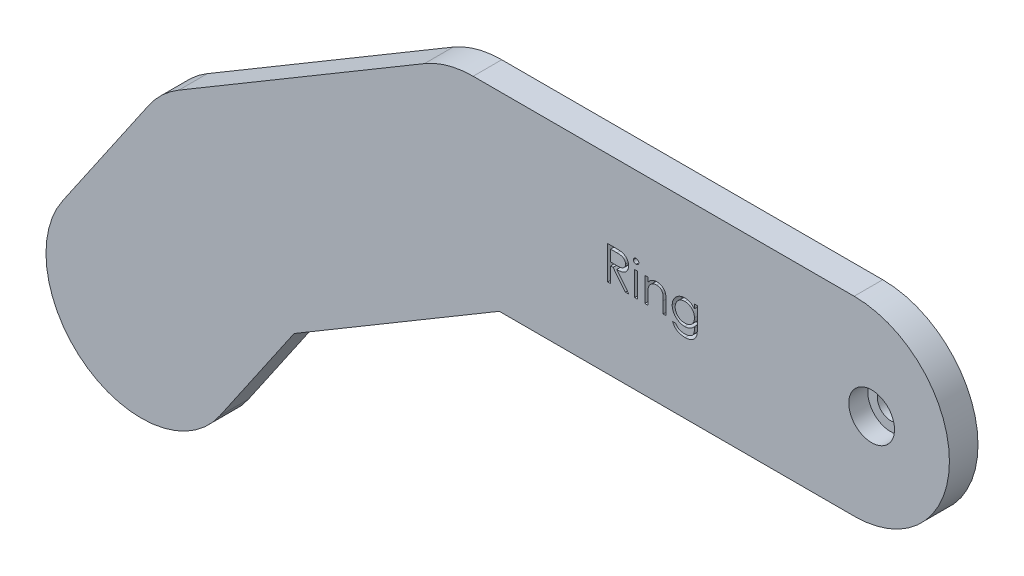
from build123d import *

# Parameters (mm, degrees)
BOSS_EXTRUDE1_DEPTH = 3
BOSS_EXTRUDE2_DEPTH = 3
BOSS_EXTRUDE4_DEPTH = 3
SKETCH4_R           = 1.4
CUT_EXTRUDE5_DEPTH  = 3
SKETCH5_R           = 2.4
CUT_EXTRUDE6_DEPTH  = 2
SKETCH7_W           = 0.314102564
SKETCH7_H           = 2.557692308
CUT_EXTRUDE7_DEPTH  = 1


with BuildPart() as part:
    # Sketch1 → Boss-Extrude1 (new body)
    with BuildSketch(Plane.XY):
        with BuildLine():
            Line((0, 10), (40, 10))
            ThreePointArc((40, 10), (50, 0), (40, -10))
            Line((40, -10), (0, -10))
            ThreePointArc((0, -10), (-10, 0), (0, 10))
        make_face()
    extrude(amount=BOSS_EXTRUDE1_DEPTH)

    # Sketch2 → Boss-Extrude2 (add)
    with BuildSketch(Plane.XY):
        with BuildLine():
            Line((5.104260767, -8.599216361), (-20.693388315, -23.911998663))
            ThreePointArc((-20.693388315, -23.911998663), (-34.396865443, -20.417043069), (-30.90190985, -6.713565941))
            Line((-30.90190985, -6.713565941), (-5.104260767, 8.599216361))
            ThreePointArc((-5.104260767, 8.599216361), (8.599216361, 5.104260767), (5.104260767, -8.599216361))
        make_face()
    extrude(amount=BOSS_EXTRUDE2_DEPTH)

    # Sketch3 → Boss-Extrude4 (add)
    with BuildSketch(Plane.XY):
        with BuildLine():
            Line((-17.548569958, -20.965453669), (-26.592844146, -34.163980269))
            ThreePointArc((-26.592844146, -34.163980269), (-40.494594638, -36.760388026), (-43.091002396, -22.858637534))
            Line((-43.091002396, -22.858637534), (-34.046728207, -9.660110934))
            ThreePointArc((-34.046728207, -9.660110934), (-20.144977715, -7.063703177), (-17.548569958, -20.965453669))
        make_face()
    extrude(amount=BOSS_EXTRUDE4_DEPTH)

    # Sketch4 → Cut-Extrude5 (cut)
    with BuildSketch(Plane.XY):
        with Locations((41.835442891, 0)):
            Circle(SKETCH4_R)
    extrude(amount=CUT_EXTRUDE5_DEPTH, mode=Mode.SUBTRACT)

    # Sketch5 → Cut-Extrude6 (cut)
    with BuildSketch(Plane.XY.offset(3)):
        with Locations((41.835442891, 0)):
            Circle(SKETCH5_R)
    extrude(amount=-CUT_EXTRUDE6_DEPTH, mode=Mode.SUBTRACT)

    # Sketch7 → Cut-Extrude7 (cut)
    # profile 1 of 5: a face of its own
    with BuildSketch(Plane.XY.offset(3)):
        with BuildLine():
            Line((14.119365842, 1.855353643), (14.819786515, 1.855353643))
            add(Edge.make_bspline(
                [(14.819786515, 1.855353643), (14.866527644, 1.855198057), (14.956275788, 1.854899315), (15.084849058, 1.853233552), (15.201676155, 1.848459197), (15.306695995, 1.844350613), (15.39990665, 1.836858672), (15.48159394, 1.829698025), (15.551381638, 1.820324364), (15.593627489, 1.811618941), (15.612755265, 1.807677361)],
                knots=[0, 0, 0, 0, 1.410062039, 2.707475311, 3.878576406, 4.937260626, 5.877586885, 6.699081471, 7.410979367, 8, 8, 8, 8], degree=3))
            add(Edge.make_bspline(
                [(15.612755265, 1.807677361), (15.638361889, 1.801350596), (15.689028879, 1.788832032), (15.761978945, 1.762372432), (15.831493269, 1.731752807), (15.897283093, 1.695789087), (15.959018884, 1.654214307), (16.017337195, 1.607746185), (16.072502658, 1.556638979), (16.122284289, 1.499604137), (16.16922334, 1.439767628), (16.208811967, 1.375063871), (16.242938447, 1.307402343), (16.270108964, 1.236094925), (16.291986937, 1.161833154), (16.307413176, 1.083944357), (16.316664364, 1.002783382), (16.31760622, 0.947425473), (16.318083791, 0.919356047)],
                knots=[0, 0, 0, 0, 1.027469482, 2.033020251, 3.019912614, 3.986113645, 4.951240523, 5.91722682, 6.890402269, 7.87763091, 8.8651537, 9.85103654, 10.82876324, 11.815024772, 12.821070561, 13.842952187, 14.906261191, 16, 16, 16, 16], degree=3))
            add(Edge.make_bspline(
                [(16.318083791, 0.919356047), (16.316614793, 0.872720943), (16.313748397, 0.781723775), (16.287023293, 0.649662893), (16.243246773, 0.526473579), (16.182923484, 0.412310941), (16.106104009, 0.309400295), (16.013779218, 0.21900984), (15.905897606, 0.143369928), (15.80546829, 0.090917123), (15.716754091, 0.057324214), (15.643720778, 0.033687855), (15.5640538, 0.01542589), (15.478516466, -0.000934242), (15.38675281, -0.013285936), (15.288982771, -0.022332531), (15.185136619, -0.027986579), (15.11379755, -0.028828584), (15.077098214, -0.029261741)],
                knots=[0, 0, 0, 0, 1.260483769, 2.459530307, 3.627416485, 4.787058657, 5.939039949, 7.08810263, 8.267026773, 9.491475466, 10.141966685, 10.831826277, 11.566392101, 12.351337768, 13.187381173, 14.07005841, 15.007169909, 16, 16, 16, 16], degree=3))
            Line((15.077098214, -0.029261741), (16.362955586, -1.644646357))
            Line((16.362955586, -1.644646357), (15.974534111, -1.644646357))
            Line((15.974534111, -1.644646357), (14.688676739, -0.029261741))
            Line((14.688676739, -0.029261741), (14.433468406, -0.029261741))
            Line((14.433468406, -0.029261741), (14.433468406, -1.644646357))
            Line((14.433468406, -1.644646357), (14.119365842, -1.644646357))
            Line((14.119365842, -1.644646357), (14.119365842, 1.855353643))
        make_face()
        with BuildLine():
            Line((14.433468406, 1.496379284), (14.433468406, 0.329712618))
            Line((14.433468406, 0.329712618), (15.074293727, 0.324804765))
            add(Edge.make_bspline(
                [(15.074293727, 0.324804765), (15.104213766, 0.324791529), (15.162207323, 0.324765872), (15.246107988, 0.328759648), (15.324228099, 0.333302967), (15.396268851, 0.340252312), (15.462262427, 0.349208384), (15.52217584, 0.360411368), (15.576106892, 0.373463431), (15.63900543, 0.393665057), (15.709241962, 0.425671075), (15.785573421, 0.472236574), (15.850575759, 0.530805693), (15.905493622, 0.597779149), (15.949623053, 0.671415398), (15.980735107, 0.750831767), (16.00047755, 0.834023365), (16.002806095, 0.891201473), (16.003981227, 0.920057169)],
                knots=[0, 0, 0, 0, 1.146690395, 2.22261258, 3.21895312, 4.145990853, 4.996080663, 5.770904154, 6.481378293, 7.121626537, 8.300444488, 9.431385265, 10.535395872, 11.636531494, 12.74115979, 13.810798291, 14.895190096, 16, 16, 16, 16], degree=3))
            add(Edge.make_bspline(
                [(16.003981227, 0.920057169), (16.002779106, 0.948203743), (16.00039694, 1.003979982), (15.980948172, 1.085635892), (15.94805879, 1.162702842), (15.903736552, 1.234867327), (15.849737397, 1.300373063), (15.786419585, 1.356420216), (15.71551439, 1.402669681), (15.649243191, 1.432224061), (15.590008979, 1.450343914), (15.538579319, 1.463095078), (15.480467841, 1.473339547), (15.415392382, 1.481547608), (15.343630752, 1.488602552), (15.264820101, 1.493354331), (15.17948332, 1.496168195), (15.120336389, 1.496307284), (15.089718406, 1.496379284)],
                knots=[0, 0, 0, 0, 1.101028733, 2.181837193, 3.264309656, 4.369019818, 5.486613113, 6.575447106, 7.666700264, 8.788928104, 9.402425223, 10.0903467, 10.862060571, 11.710948788, 12.657782767, 13.684531032, 14.801375019, 16, 16, 16, 16], degree=3))
            Line((15.089718406, 1.496379284), (14.433468406, 1.496379284))
        make_face(mode=Mode.SUBTRACT)
    # profile 2 of 5: a face of its own
    with BuildSketch(Plane.XY.offset(3)):
        with BuildLine():
            add(Edge.make_bspline(
                [(17.101937957, 1.989969028), (17.121429273, 1.989064876), (17.159597013, 1.987294372), (17.214790281, 1.972132895), (17.265047293, 1.946433209), (17.309625026, 1.911953528), (17.347876912, 1.871404085), (17.374657623, 1.824143116), (17.391870019, 1.773084478), (17.393948574, 1.737469388), (17.395006868, 1.719336015)],
                knots=[0, 0, 0, 0, 1.055194115, 2.066272739, 3.074728998, 4.095836921, 5.109056067, 6.073838105, 7.019297344, 8, 8, 8, 8], degree=3))
            add(Edge.make_bspline(
                [(17.395006868, 1.719336015), (17.393924708, 1.701673362), (17.391785406, 1.666756387), (17.374670918, 1.616582915), (17.34764868, 1.569978632), (17.309649554, 1.529507921), (17.265040793, 1.495047301), (17.214792007, 1.469342562), (17.159596559, 1.454182425), (17.12142912, 1.452411736), (17.101937957, 1.45150749)],
                knots=[0, 0, 0, 0, 0.96129708, 1.900370562, 2.859976407, 3.87933698, 4.906634145, 5.921202961, 6.938410037, 8, 8, 8, 8], degree=3))
            add(Edge.make_bspline(
                [(17.101937957, 1.45150749), (17.082669682, 1.45237721), (17.045166502, 1.454070007), (16.99079966, 1.469640024), (16.94097117, 1.495056097), (16.896306498, 1.529282283), (16.859076305, 1.57022718), (16.831977979, 1.616554474), (16.814903017, 1.666763628), (16.812758389, 1.701675795), (16.811673534, 1.719336015)],
                knots=[0, 0, 0, 0, 1.054934014, 2.053291228, 3.073705704, 4.106921865, 5.123545215, 6.088680038, 7.033164197, 8, 8, 8, 8], degree=3))
            add(Edge.make_bspline(
                [(16.811673534, 1.719336015), (16.812734621, 1.737466865), (16.814818662, 1.773076997), (16.831990778, 1.82417203), (16.858850586, 1.871153532), (16.896331149, 1.912179032), (16.94096461, 1.946424466), (16.990801355, 1.971835448), (17.045166054, 1.987406787), (17.08266953, 1.989099402), (17.101937957, 1.989969028)],
                knots=[0, 0, 0, 0, 0.98631895, 1.937192651, 2.907499808, 3.917963147, 4.944918757, 5.95915025, 6.951458133, 8, 8, 8, 8], degree=3))
        make_face()
    # profile 3 of 5: a face of its own
    with BuildSketch(Plane.XY.offset(3)):
        with Locations((17.103340201, -0.365800203)):
            Rectangle(SKETCH7_W, SKETCH7_H)
    # profile 4 of 5: a face of its own
    with BuildSketch(Plane.XY.offset(3)):
        with BuildLine():
            Line((18.023211996, 0.913045951), (18.33731456, 0.913045951))
            Line((18.33731456, 0.913045951), (18.33731456, 0.45170781))
            add(Edge.make_bspline(
                [(18.33731456, 0.45170781), (18.370852195, 0.493550533), (18.435933146, 0.574747796), (18.544317479, 0.681468371), (18.65886138, 0.769413596), (18.778863383, 0.83951739), (18.904486393, 0.892364016), (19.034964663, 0.930529947), (19.171079369, 0.953414776), (19.263643806, 0.956405006), (19.310471611, 0.957917746)],
                knots=[0, 0, 0, 0, 1.12780773, 2.188550248, 3.19190651, 4.159438251, 5.104880172, 6.052711206, 7.014878035, 8, 8, 8, 8], degree=3))
            add(Edge.make_bspline(
                [(19.310471611, 0.957917746), (19.357802245, 0.956172551), (19.450439713, 0.952756782), (19.585317775, 0.925740091), (19.711291168, 0.879594836), (19.827910724, 0.816382766), (19.933037937, 0.737776292), (20.025362789, 0.64619851), (20.101726036, 0.540862427), (20.152923399, 0.443139271), (20.186649047, 0.356450477), (20.207881384, 0.282203727), (20.225912366, 0.199485575), (20.241544114, 0.108545986), (20.252121226, 0.008747796), (20.260463517, -0.099499896), (20.266442212, -0.216162027), (20.266679419, -0.296848654), (20.266801739, -0.338456453)],
                knots=[0, 0, 0, 0, 1.235846778, 2.418850247, 3.575807741, 4.728682307, 5.871620074, 6.994088408, 8.11269785, 9.256955736, 9.865816715, 10.540099792, 11.271859618, 12.076849838, 12.949306005, 13.892391288, 14.913166135, 16, 16, 16, 16], degree=3))
            Line((20.266801739, -0.338456453), (20.266801739, -1.644646357))
            Line((20.266801739, -1.644646357), (19.952699175, -1.644646357))
            Line((19.952699175, -1.644646357), (19.952699175, -0.441521357))
            add(Edge.make_bspline(
                [(19.952699175, -0.441521357), (19.952505967, -0.406698912), (19.952136393, -0.340089501), (19.950970747, -0.244720478), (19.94816094, -0.158233899), (19.944212627, -0.080836532), (19.938433597, -0.012602695), (19.932410965, 0.046606581), (19.925045988, 0.096716124), (19.918483075, 0.126881206), (19.91553972, 0.140409733)],
                knots=[0, 0, 0, 0, 1.430800155, 2.736877192, 3.918605307, 4.986035426, 5.920637409, 6.731861385, 7.431261377, 8, 8, 8, 8], degree=3))
            add(Edge.make_bspline(
                [(19.91553972, 0.140409733), (19.904914189, 0.180120918), (19.884463328, 0.256552663), (19.833929345, 0.360227015), (19.770115164, 0.448425203), (19.692217315, 0.520601925), (19.600988239, 0.576772762), (19.496681096, 0.615746716), (19.380302456, 0.640122985), (19.298448073, 0.642550118), (19.255784111, 0.643815182)],
                knots=[0, 0, 0, 0, 1.084156227, 2.086665306, 3.027808233, 3.945421172, 4.874247719, 5.839848303, 6.874090471, 8, 8, 8, 8], degree=3))
            add(Edge.make_bspline(
                [(19.255784111, 0.643815182), (19.230516428, 0.643339177), (19.180512335, 0.642397176), (19.106362363, 0.632945878), (19.03443819, 0.617487423), (18.964017981, 0.596618785), (18.896510187, 0.567956516), (18.829745896, 0.535427146), (18.766239132, 0.494878934), (18.704635734, 0.449688312), (18.647322927, 0.399609105), (18.593994588, 0.346764595), (18.546456568, 0.290488991), (18.503387893, 0.231689044), (18.466209629, 0.169557206), (18.433756541, 0.104692899), (18.406220847, 0.03701075), (18.392538154, -0.009964311), (18.385691964, -0.033468472)],
                knots=[0, 0, 0, 0, 1.023777757, 2.026029729, 3.023749952, 4.003683103, 4.997618607, 5.993177895, 7.010360494, 8.046726602, 9.087585522, 10.09234134, 11.086953743, 12.070360549, 13.043493632, 14.017870808, 15.008233677, 16, 16, 16, 16], degree=3))
            add(Edge.make_bspline(
                [(18.385691964, -0.033468472), (18.381752315, -0.050723675), (18.373175906, -0.088287349), (18.363912727, -0.149931769), (18.355505151, -0.221241744), (18.348468193, -0.302134061), (18.344162776, -0.392891936), (18.339468379, -0.493127774), (18.337759318, -0.603241262), (18.337466964, -0.679902955), (18.33731456, -0.719866709)],
                knots=[0, 0, 0, 0, 0.615963638, 1.340920617, 2.168419149, 3.115676021, 4.16674242, 5.331190069, 6.6087489, 8, 8, 8, 8], degree=3))
            Line((18.33731456, -0.719866709), (18.33731456, -1.644646357))
            Line((18.33731456, -1.644646357), (18.023211996, -1.644646357))
            Line((18.023211996, -1.644646357), (18.023211996, 0.913045951))
        make_face()
    # profile 5 of 5: a face of its own
    with BuildSketch(Plane.XY.offset(3)):
        with BuildLine():
            Line((23.228340201, 0.913045951), (23.542442765, 0.913045951))
            Line((23.542442765, 0.913045951), (23.542442765, -1.116701645))
            add(Edge.make_bspline(
                [(23.542442765, -1.116701645), (23.542165723, -1.15993924), (23.541630964, -1.243398212), (23.537779992, -1.364076492), (23.529659315, -1.475542577), (23.520450634, -1.578304836), (23.507203918, -1.671886946), (23.49102755, -1.756568151), (23.472791871, -1.832429713), (23.456771654, -1.879154554), (23.449193566, -1.901256933)],
                knots=[0, 0, 0, 0, 1.307562039, 2.523909702, 3.650326591, 4.686913197, 5.643429486, 6.506965704, 7.293745905, 8, 8, 8, 8], degree=3))
            add(Edge.make_bspline(
                [(23.449193566, -1.901256933), (23.438004328, -1.929986855), (23.415960401, -1.986587692), (23.374674768, -2.066822013), (23.328440864, -2.142368403), (23.275634114, -2.212805854), (23.216493309, -2.277780766), (23.152411817, -2.338704766), (23.082141626, -2.394288933), (23.005722914, -2.443574231), (22.924917281, -2.487961285), (22.839771178, -2.526407852), (22.75076474, -2.559894695), (22.657061848, -2.584977491), (22.560131614, -2.606712212), (22.458834183, -2.620856898), (22.353761386, -2.630483956), (22.282316006, -2.631374189), (22.246068566, -2.631825844)],
                knots=[0, 0, 0, 0, 0.981931301, 1.934503488, 2.87077864, 3.801706999, 4.735015492, 5.667491629, 6.616593066, 7.585388521, 8.561939025, 9.551802639, 10.560317337, 11.588439944, 12.640189604, 13.723962949, 14.845264515, 16, 16, 16, 16], degree=3))
            add(Edge.make_bspline(
                [(22.246068566, -2.631825844), (22.193183832, -2.630969358), (22.089885737, -2.629296411), (21.939280744, -2.609805496), (21.796246024, -2.582251123), (21.662671567, -2.540545695), (21.53940147, -2.489508705), (21.427277595, -2.430913753), (21.327306487, -2.363724444), (21.237182814, -2.287223843), (21.155841224, -2.196260161), (21.079313934, -2.089061317), (21.005652992, -1.963994428), (20.962484355, -1.872201715), (20.939878663, -1.824133536)],
                knots=[0, 0, 0, 0, 1.157897085, 2.2616841, 3.32207898, 4.345638746, 5.321241055, 6.241986252, 7.112515963, 7.955008012, 8.825025602, 9.77857164, 10.836726669, 12, 12, 12, 12], degree=3))
            Line((20.939878663, -1.824133536), (21.253981227, -1.824133536))
            add(Edge.make_bspline(
                [(21.253981227, -1.824133536), (21.279243436, -1.864239412), (21.328627944, -1.94264146), (21.420976425, -2.044154616), (21.522182752, -2.130907981), (21.635662435, -2.200818755), (21.76188765, -2.253528546), (21.900934336, -2.291103843), (22.053933958, -2.31360011), (22.160452172, -2.316311404), (22.215920329, -2.31772328)],
                knots=[0, 0, 0, 0, 0.997731894, 1.950442991, 2.880492273, 3.800895997, 4.748200782, 5.754801363, 6.83083817, 8, 8, 8, 8], degree=3))
            add(Edge.make_bspline(
                [(22.215920329, -2.31772328), (22.27068722, -2.316293131), (22.376272302, -2.313535947), (22.528103471, -2.291093803), (22.666698409, -2.253520369), (22.79125861, -2.200911983), (22.900314379, -2.136461576), (22.99432637, -2.064461502), (23.070471046, -1.983280499), (23.121684013, -1.908498693), (23.15351863, -1.841874563), (23.173790867, -1.784521967), (23.190264836, -1.71966909), (23.204044674, -1.647533353), (23.215415587, -1.568011696), (23.22261847, -1.480922293), (23.227824281, -1.386463071), (23.228164251, -1.320969932), (23.228340201, -1.287074241)],
                knots=[0, 0, 0, 0, 1.570740765, 3.028230971, 4.391408896, 5.680370741, 6.894727393, 8.017376726, 9.065722033, 10.075533815, 10.603371122, 11.180248986, 11.817768598, 12.521299649, 13.286540596, 14.121245857, 15.027658897, 16, 16, 16, 16], degree=3))
            Line((23.228340201, -1.287074241), (23.228340201, -1.154562222))
            add(Edge.make_bspline(
                [(23.228340201, -1.154562222), (23.196459084, -1.192504024), (23.133257628, -1.267720244), (23.024110301, -1.36628188), (22.904893385, -1.451168011), (22.775809843, -1.520786645), (22.640021601, -1.57646807), (22.49899937, -1.615411031), (22.354007315, -1.640570931), (22.255755165, -1.643278247), (22.206104624, -1.644646357)],
                knots=[0, 0, 0, 0, 1.012485704, 2.007162095, 2.997754123, 3.998611389, 4.999708251, 5.992315798, 6.98544096, 8, 8, 8, 8], degree=3))
            add(Edge.make_bspline(
                [(22.206104624, -1.644646357), (22.176868355, -1.64413133), (22.118741797, -1.643107372), (22.03238705, -1.634148595), (21.947306612, -1.621149852), (21.863698908, -1.602068413), (21.781443295, -1.577576687), (21.700675703, -1.546959948), (21.620742176, -1.51234483), (21.543095678, -1.471572026), (21.468509548, -1.426209719), (21.397546362, -1.377070829), (21.330577823, -1.32441254), (21.268241334, -1.267715601), (21.210618662, -1.207062068), (21.156934794, -1.143098515), (21.108077447, -1.074931773), (21.063044058, -1.003804816), (21.023986508, -0.929243892), (20.989702136, -0.852865797), (20.959892731, -0.774833842), (20.936127329, -0.69488678), (20.917976216, -0.613075011), (20.904465989, -0.529532562), (20.896803057, -0.444002174), (20.895608133, -0.386380825), (20.895006868, -0.357386741)],
                knots=[0, 0, 0, 0, 1.028754217, 2.045334182, 3.052854819, 4.056607503, 5.061168794, 6.071104265, 7.095078842, 8.125279047, 9.155117945, 10.165957491, 11.161587969, 12.151493252, 13.128948131, 14.104219989, 15.088194871, 16.07871515, 17.064853787, 18.047899887, 19.02414258, 20.002704429, 20.980574569, 21.971845993, 22.979467364, 24, 24, 24, 24], degree=3))
            add(Edge.make_bspline(
                [(20.895006868, -0.357386741), (20.895526034, -0.328383645), (20.896562356, -0.270489786), (20.905513335, -0.184610401), (20.918281524, -0.099880966), (20.938489293, -0.017174824), (20.962811816, 0.064449928), (20.992935389, 0.144390384), (21.029154148, 0.222670893), (21.070163898, 0.299349425), (21.11624799, 0.37339704), (21.166780471, 0.443723686), (21.221822345, 0.509811857), (21.280614261, 0.572328279), (21.343874078, 0.630669773), (21.41156907, 0.684694737), (21.483031951, 0.735308764), (21.558484201, 0.781420101), (21.636761589, 0.822202347), (21.715875407, 0.859414944), (21.796873642, 0.888949064), (21.878246181, 0.914972163), (21.961426096, 0.933407358), (22.04539349, 0.9476296), (22.130435827, 0.956294321), (22.187388722, 0.957375906), (22.215920329, 0.957917746)],
                knots=[0, 0, 0, 0, 1.008818848, 2.013730394, 3.001654427, 3.987803273, 4.973046549, 5.963777569, 6.957074694, 7.972068341, 8.987420212, 9.989399531, 10.982630087, 11.977756091, 12.973280677, 13.973972381, 14.989194003, 16.018387222, 17.047741039, 18.059210846, 19.057554164, 20.045176975, 21.029480261, 22.018708529, 23.007435371, 24, 24, 24, 24], degree=3))
            add(Edge.make_bspline(
                [(22.215920329, 0.957917746), (22.262971268, 0.956561073), (22.355882416, 0.95388206), (22.492613418, 0.932860914), (22.624555658, 0.899346901), (22.752453674, 0.851331271), (22.877349325, 0.785781232), (22.99883098, 0.699438284), (23.117250114, 0.591527945), (23.190327945, 0.50877508), (23.228340201, 0.465730246)],
                knots=[0, 0, 0, 0, 0.96728863, 1.910097829, 2.838038873, 3.762875196, 4.71315279, 5.730631239, 6.819562287, 8, 8, 8, 8], degree=3))
            Line((23.228340201, 0.465730246), (23.228340201, 0.913045951))
        make_face()
        with BuildLine():
            add(Edge.make_bspline(
                [(22.241160714, 0.643815182), (22.19523001, 0.642254116), (22.104296956, 0.639163538), (21.971008613, 0.612778825), (21.84233168, 0.571432925), (21.720726251, 0.512290309), (21.606819142, 0.440196071), (21.505744321, 0.352855784), (21.417339405, 0.253109587), (21.342556467, 0.14185934), (21.2830251, 0.021837064), (21.240881681, -0.10467367), (21.213631657, -0.235628663), (21.210624005, -0.325001266), (21.209109432, -0.370006933)],
                knots=[0, 0, 0, 0, 1.026226791, 2.031711442, 3.026614839, 4.04107745, 5.047145931, 6.032893242, 7.017642609, 8.019221815, 9.021877557, 10.003543541, 10.994637589, 12, 12, 12, 12], degree=3))
            add(Edge.make_bspline(
                [(21.209109432, -0.370006933), (21.209835189, -0.403940206), (21.21126254, -0.47067703), (21.224986118, -0.568614925), (21.247167083, -0.661895238), (21.278604289, -0.750523613), (21.317556984, -0.835008408), (21.366549355, -0.914767642), (21.424200327, -0.989872349), (21.490058665, -1.05976703), (21.562635047, -1.123427999), (21.641354246, -1.179366039), (21.726109496, -1.22511676), (21.814816306, -1.264657598), (21.909627062, -1.293536666), (22.009176148, -1.315575445), (22.114167844, -1.328184202), (22.185739584, -1.329747), (22.222230425, -1.330543792)],
                knots=[0, 0, 0, 0, 1.039728707, 2.044842319, 3.024901384, 3.974314358, 4.923051295, 5.871625912, 6.837440708, 7.820715446, 8.810779094, 9.792721783, 10.773906224, 11.758876063, 12.764959493, 13.806266761, 14.881525401, 16, 16, 16, 16], degree=3))
            add(Edge.make_bspline(
                [(22.222230425, -1.330543792), (22.259194184, -1.329776183), (22.331476421, -1.328275132), (22.437047357, -1.315371633), (22.537080098, -1.294549657), (22.63148292, -1.264986632), (22.720612261, -1.227264881), (22.803466876, -1.179528264), (22.881823324, -1.125163832), (22.953179733, -1.061751817), (23.017703899, -0.991866822), (23.073934666, -0.915821927), (23.121849115, -0.834761408), (23.161526785, -0.748694403), (23.191817989, -0.65695205), (23.212136894, -0.559763694), (23.226343639, -0.457594955), (23.227664564, -0.387586339), (23.228340201, -0.351777767)],
                knots=[0, 0, 0, 0, 1.121943988, 2.193949579, 3.223793937, 4.220241907, 5.192961521, 6.155822191, 7.11847367, 8.083710714, 9.04790392, 10.001595906, 10.949595423, 11.902125208, 12.873731292, 13.87582262, 14.913508608, 16, 16, 16, 16], degree=3))
            add(Edge.make_bspline(
                [(23.228340201, -0.351777767), (23.227000633, -0.305159913), (23.224383587, -0.214085008), (23.19968643, -0.08137824), (23.15986622, 0.043390434), (23.104019467, 0.15982641), (23.034037459, 0.26669596), (22.94974661, 0.362019804), (22.852600579, 0.445920661), (22.742878479, 0.515818854), (22.624831034, 0.572284289), (22.501309838, 0.614646061), (22.372498274, 0.638640376), (22.285191864, 0.642080319), (22.241160714, 0.643815182)],
                knots=[0, 0, 0, 0, 1.070913519, 2.092188694, 3.091357305, 4.074328408, 5.051968682, 6.018948707, 6.99050112, 7.9935919, 9.000589572, 9.992915277, 10.987769056, 12, 12, 12, 12], degree=3))
        make_face(mode=Mode.SUBTRACT)
    extrude(amount=-CUT_EXTRUDE7_DEPTH, mode=Mode.SUBTRACT)


solid = part.part
